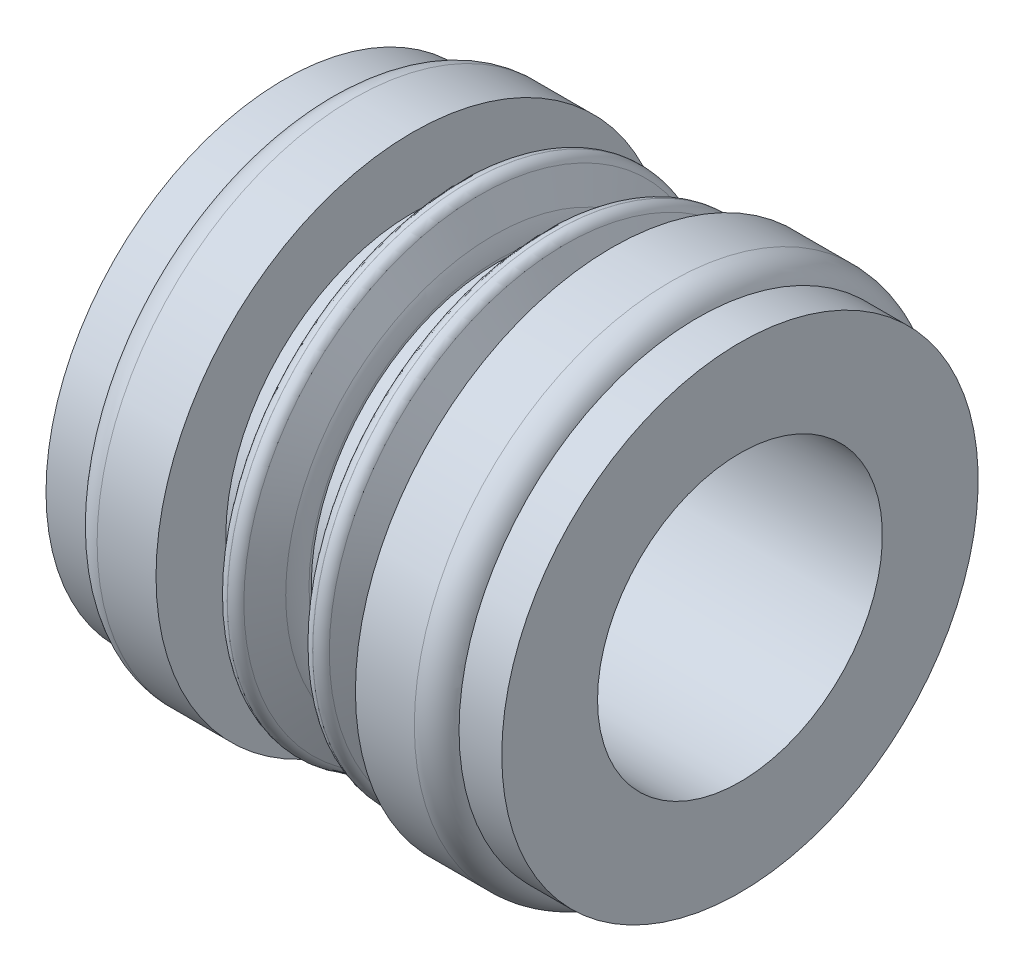
from build123d import *


with BuildPart() as part:
    # Sketch2 → Revolve1 (revolve)
    with BuildSketch(Plane(origin=(0, 0, 0), x_dir=(1, 0, 0), z_dir=(0, 1, 0)), mode=Mode.PRIVATE) as revolve1_sk:
        with BuildLine():
            Line((-8, 5), (8, 5))
            Line((8, 5), (8, 8.362238571))
            Line((8, 8.362238571), (6.5, 8.362238571))
            ThreePointArc((6.5, 8.362238571), (6.132609827, 8.825299513), (5.567914587, 9))
            Line((5.567914587, 9), (3.5, 9))
            Line((3.5, 9), (3.5, 6.55))
            Line((3.5, 6.55), (2.5, 6.55))
            Line((2.5, 6.55), (2.5, 6.629333039))
            ThreePointArc((2.5, 6.629333039), (2.460819188, 6.969931482), (2.345323601, 7.292736694))
            Line((2.345323601, 7.292736694), (1.860010919, 8.276907641))
            ThreePointArc((1.860010919, 8.276907641), (1.712488809, 8.439678566), (1.501257959, 8.5))
            Line((1.501257959, 8.5), (1.498742041, 8.5))
            ThreePointArc((1.498742041, 8.5), (1.287511191, 8.439678566), (1.139989081, 8.276907641))
            Line((1.139989081, 8.276907641), (0.654676399, 7.292736694))
            ThreePointArc((0.654676399, 7.292736694), (0.539180812, 6.969931482), (0.5, 6.629333039))
            Line((0.5, 6.629333039), (0.5, 6.55))
            Line((0.5, 6.55), (-0.5, 6.55))
            Line((-0.5, 6.55), (-0.5, 6.629333039))
            ThreePointArc((-0.5, 6.629333039), (-0.539180812, 6.969931482), (-0.654676399, 7.292736694))
            Line((-0.654676399, 7.292736694), (-1.139989081, 8.276907641))
            ThreePointArc((-1.139989081, 8.276907641), (-1.287511191, 8.439678566), (-1.498742041, 8.5))
            Line((-1.498742041, 8.5), (-1.501257959, 8.5))
            ThreePointArc((-1.501257959, 8.5), (-1.712488809, 8.439678566), (-1.860010919, 8.276907641))
            Line((-1.860010919, 8.276907641), (-2.345323601, 7.292736694))
            ThreePointArc((-2.345323601, 7.292736694), (-2.460819188, 6.969931482), (-2.5, 6.629333039))
            Line((-2.5, 6.629333039), (-2.5, 6.55))
            Line((-2.5, 6.55), (-3.5, 6.55))
            Line((-3.5, 6.55), (-3.5, 9))
            Line((-3.5, 9), (-5.567914587, 9))
            ThreePointArc((-5.567914587, 9), (-6.132609827, 8.825299513), (-6.5, 8.362238571))
            Line((-6.5, 8.362238571), (-8, 8.362238571))
            Line((-8, 8.362238571), (-8, 5))
        make_face()
    revolve(revolve1_sk.sketch.rotate(Axis((-34.59047619, 0, 0), (1, 0, 0)), 180), axis=Axis((-34.59047619, 0, 0), (1, 0, 0)))


solid = part.part
